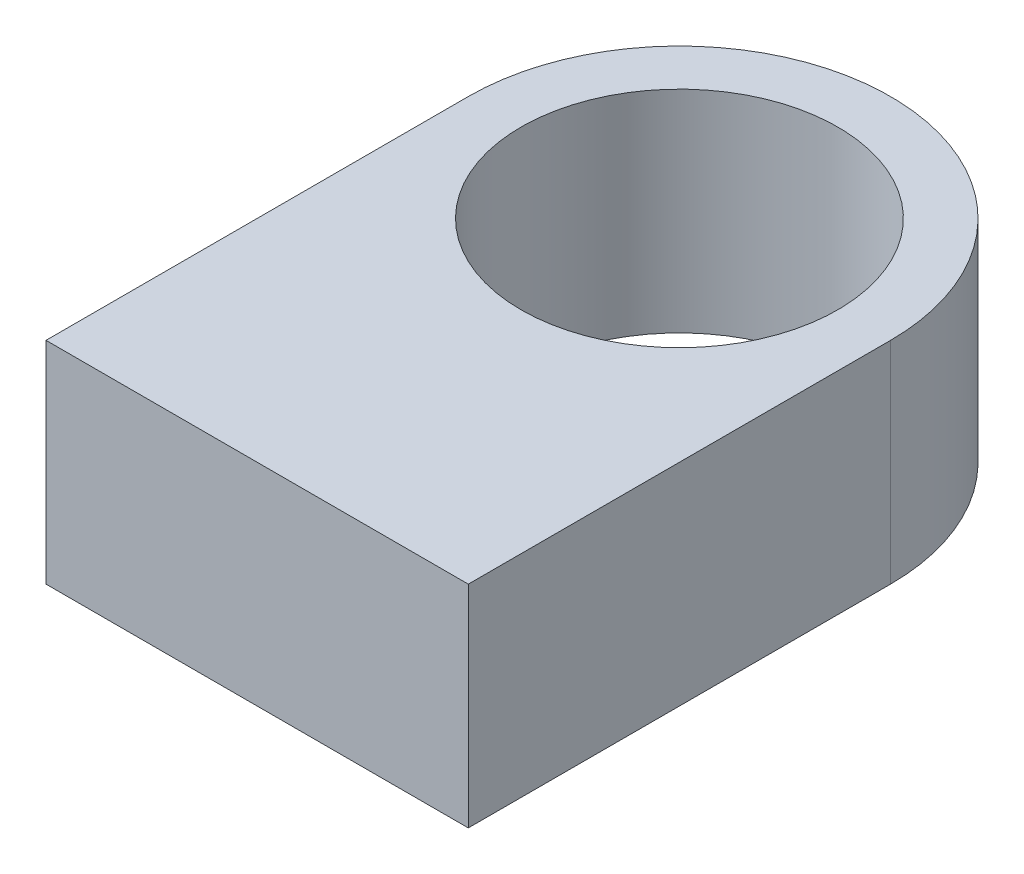
from build123d import *

# Parameters (mm, degrees)
ESQUISSE1_R        = 7.5
BOSS_EXTRU_1_DEPTH = 10


with BuildPart() as part:
    # Esquisse1 → Boss.-Extru.1 (new body)
    with BuildSketch(Plane(origin=(0, 0, 0), x_dir=(1, 0, 0), z_dir=(0, 1, 0))):
        with BuildLine():
            Line((-10, 0), (10, 0))
            Line((10, 0), (10, 20))
            ThreePointArc((10, 20), (0, 30), (-10, 20))
            Line((-10, 20), (-10, 0))
        make_face()
        with Locations(Location((0, 20, 0), (0, 0, 270))):
            Circle(ESQUISSE1_R, mode=Mode.SUBTRACT)
    extrude(amount=BOSS_EXTRU_1_DEPTH)


solid = part.part
